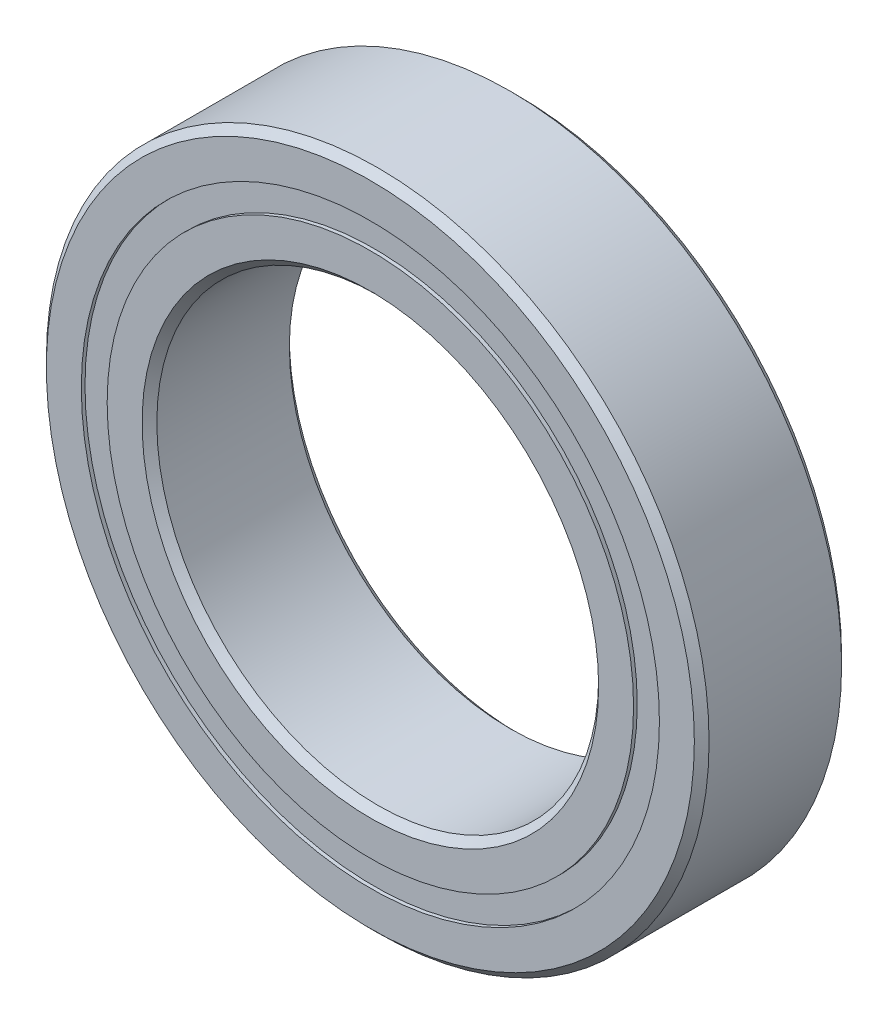
from build123d import *

# Parameters (mm, degrees)
CIRPATTERN1_COUNT = 12
SKETCH5_W         = 1.09624822
SKETCH5_H         = 0.702296138


with BuildPart() as part:
    # Sketch1 → Revolve1 (revolve)
    with BuildSketch(Plane(origin=(0, 0, 0), x_dir=(0, 0, -1), z_dir=(1, 0, 0))):
        with BuildLine():
            Line((1.8, 9), (-1.8, 9))
            Line((-1.8, 9), (-2, 8.8))
            Line((-2, 8.8), (-2, 7.851148069))
            Line((-2, 7.851148069), (-0.888888889, 7.851148069))
            ThreePointArc((-0.888888889, 7.851148069), (0, 8.489297022), (0.888888889, 7.851148069))
            Line((0.888888889, 7.851148069), (2, 7.851148069))
            Line((2, 7.851148069), (2, 8.8))
            Line((2, 8.8), (1.8, 9))
        make_face()
    revolve(axis=Axis((0, 0, 2), (0, 0, -1)))


with BuildPart() as body_2:
    # Sketch3 → Revolve3 (revolve)
    with BuildSketch(Plane(origin=(0, 0, 0), x_dir=(0, 0, -1), z_dir=(1, 0, 0))):
        with BuildLine():
            Line((-2, 7.148851931), (-0.888888889, 7.148851931))
            ThreePointArc((-0.888888889, 7.148851931), (0, 6.510702978), (0.888888889, 7.148851931))
            Line((0.888888889, 7.148851931), (2, 7.148851931))
            Line((2, 7.148851931), (2, 6.2))
            Line((2, 6.2), (1.8, 6))
            Line((1.8, 6), (-1.8, 6))
            Line((-1.8, 6), (-2, 6.2))
            Line((-2, 6.2), (-2, 7.148851931))
        make_face()
    revolve(axis=Axis((0, 0, 2), (0, 0, -1)))


with BuildPart() as body_3:
    # Sketch4 → Revolve4 (revolve)
    with BuildSketch(Plane(origin=(0, 0, 0), x_dir=(0, 0, -1), z_dir=(1, 0, 0))):
        with BuildLine():
            Line((-0.80375178, 7.551148069), (0.80375178, 7.551148069))
            ThreePointArc((0.80375178, 7.551148069), (0, 8.354899849), (-0.80375178, 7.551148069))
        make_face()
    revolve(axis=Axis((0, 7.551148069, 0.80375178), (0, 0, -1)))


with BuildPart() as cirpattern1_1:
    # CirPattern1: pattern copy
    add(body_3.part.rotate(Axis((0, 0, -2), (0, 0, 1)), 1 * 360 / CIRPATTERN1_COUNT))


with BuildPart() as cirpattern1_2:
    # CirPattern1: pattern copy
    add(body_3.part.rotate(Axis((0, 0, -2), (0, 0, 1)), 2 * 360 / CIRPATTERN1_COUNT))


with BuildPart() as cirpattern1_3:
    # CirPattern1: pattern copy
    add(body_3.part.rotate(Axis((0, 0, -2), (0, 0, 1)), 3 * 360 / CIRPATTERN1_COUNT))


with BuildPart() as cirpattern1_4:
    # CirPattern1: pattern copy
    add(body_3.part.rotate(Axis((0, 0, -2), (0, 0, 1)), 4 * 360 / CIRPATTERN1_COUNT))


with BuildPart() as cirpattern1_5:
    # CirPattern1: pattern copy
    add(body_3.part.rotate(Axis((0, 0, -2), (0, 0, 1)), 5 * 360 / CIRPATTERN1_COUNT))


with BuildPart() as cirpattern1_6:
    # CirPattern1: pattern copy
    add(body_3.part.rotate(Axis((0, 0, -2), (0, 0, 1)), 6 * 360 / CIRPATTERN1_COUNT))


with BuildPart() as cirpattern1_7:
    # CirPattern1: pattern copy
    add(body_3.part.rotate(Axis((0, 0, -2), (0, 0, 1)), 7 * 360 / CIRPATTERN1_COUNT))


with BuildPart() as cirpattern1_8:
    # CirPattern1: pattern copy
    add(body_3.part.rotate(Axis((0, 0, -2), (0, 0, 1)), 8 * 360 / CIRPATTERN1_COUNT))


with BuildPart() as cirpattern1_9:
    # CirPattern1: pattern copy
    add(body_3.part.rotate(Axis((0, 0, -2), (0, 0, 1)), 9 * 360 / CIRPATTERN1_COUNT))


with BuildPart() as cirpattern1_10:
    # CirPattern1: pattern copy
    add(body_3.part.rotate(Axis((0, 0, -2), (0, 0, 1)), 10 * 360 / CIRPATTERN1_COUNT))


with BuildPart() as cirpattern1_11:
    # CirPattern1: pattern copy
    add(body_3.part.rotate(Axis((0, 0, -2), (0, 0, 1)), 11 * 360 / CIRPATTERN1_COUNT))


with BuildPart() as body_15:
    # Sketch5 → Revolve5 (revolve)
    with BuildSketch(Plane(origin=(0, 0, 0), x_dir=(0, 0, -1), z_dir=(1, 0, 0))):
        with Locations((-1.35187589, 7.5)):
            Rectangle(SKETCH5_W, SKETCH5_H)
        with Locations((1.35187589, 7.5)):
            Rectangle(SKETCH5_W, SKETCH5_H)
    revolve(axis=Axis((0, 0, 2), (0, 0, -1)))


solid = Compound([part.part, body_2.part, body_3.part, cirpattern1_1.part, cirpattern1_2.part, cirpattern1_3.part, cirpattern1_4.part, cirpattern1_5.part, cirpattern1_6.part, cirpattern1_7.part, cirpattern1_8.part, cirpattern1_9.part, cirpattern1_10.part, cirpattern1_11.part, body_15.part])
